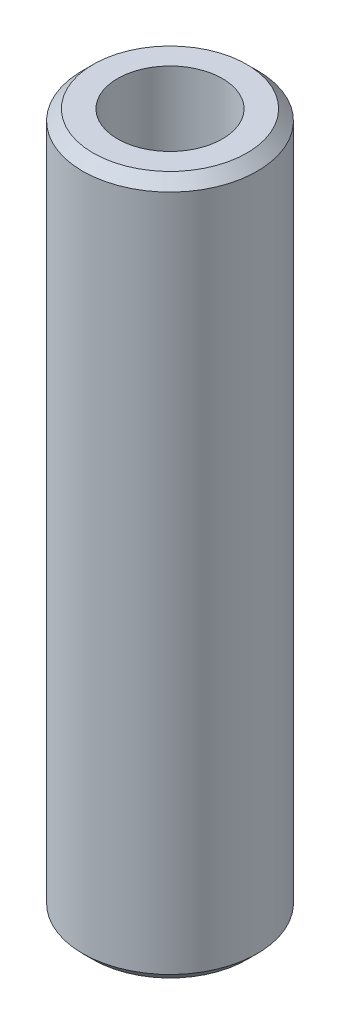
from build123d import *

# Parameters (mm, degrees)
SKETCH_1_R      = 2.5
SKETCH_1_R_2    = 1.5
EXTRUDE_1_DEPTH = 20
CHAMFER_1_SIZE  = 0.3


with BuildPart() as part:
    # 草图1 → 凸台-拉伸1 (new body)
    with BuildSketch(Plane(origin=(0, 0, 0), x_dir=(1, 0, 0), z_dir=(0, 1, 0))):
        with Locations(Location((0, 0, 0), (0, 0, 270))):
            Circle(SKETCH_1_R)
        with Locations(Location((0, 0, 0), (0, 0, 270))):
            Circle(SKETCH_1_R_2, mode=Mode.SUBTRACT)
    extrude(amount=EXTRUDE_1_DEPTH)

    # 倒角1
    chamfer_1_edges = [part.edges().sort_by_distance(p)[0] for p in [
        (0, 0, -2.5),
        (0, 20, -2.5),
    ]]
    chamfer(chamfer_1_edges, length=CHAMFER_1_SIZE)


solid = part.part
